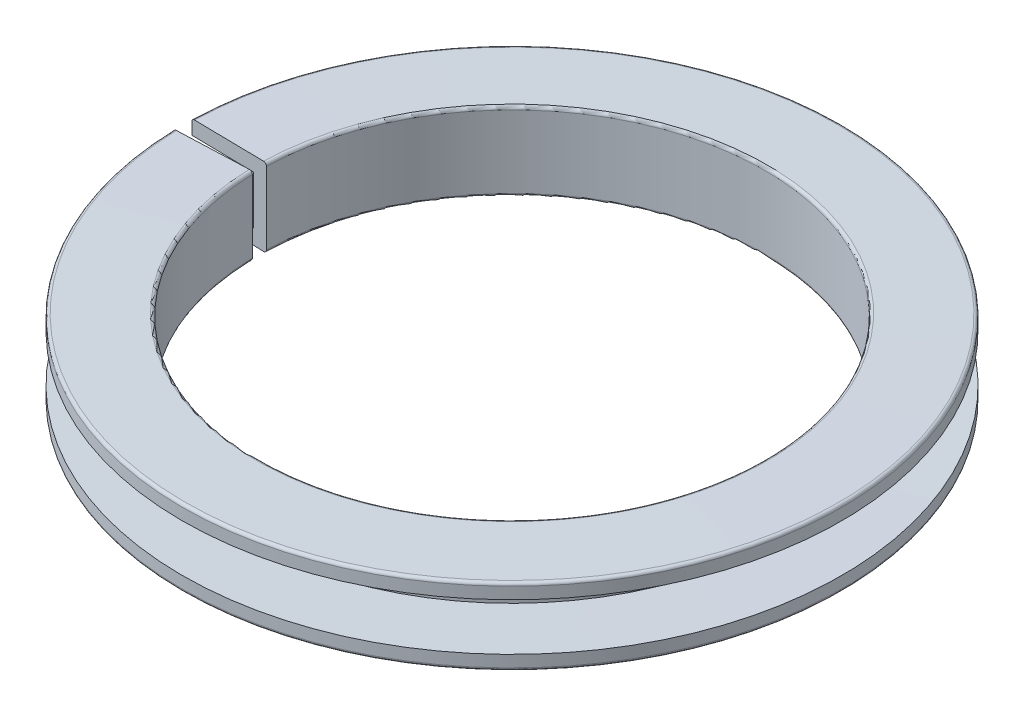
from build123d import *


with BuildPart() as part:
    # ｽｲｰﾌﾟ1: sweep along a path in ｽｹｯﾁ2
    with BuildLine(Plane(origin=(0, 0, 0), x_dir=(1, 0, 0), z_dir=(0, 1, 0))) as sweep_1_path:
        ThreePointArc((-35.993054215, -0.5), (0, 0), (-35.993054215, 0.5))
    # ｽｹｯﾁ1 → ｽｲｰﾌﾟ1 (sweep)
    with BuildSketch(Plane.XY):
        with BuildLine():
            Line((4.3, -1.6), (4.3, -2.391846945))
            ThreePointArc((4.3, -2.391846945), (4.242241142, -2.532443736), (4.102325424, -2.591833425))
            Line((4.102325424, -2.591833425), (-0.697674576, -2.647647379))
            ThreePointArc((-0.697674576, -2.647647379), (-0.840596791, -2.58990204), (-0.9, -2.447660898))
            Line((-0.9, -2.447660898), (-0.9, 2.447660898))
            ThreePointArc((-0.9, 2.447660898), (-0.840596791, 2.58990204), (-0.697674576, 2.647647379))
            Line((-0.697674576, 2.647647379), (4.102325424, 2.591833425))
            ThreePointArc((4.102325424, 2.591833425), (4.242241142, 2.532443736), (4.3, 2.391846945))
            Line((4.3, 2.391846945), (4.3, 1.6))
            Line((4.3, 1.6), (0, 1.65))
            Line((0, 1.65), (0, -1.65))
            Line((0, -1.65), (4.3, -1.6))
        make_face()
    sweep(path=sweep_1_path.line)


solid = part.part
